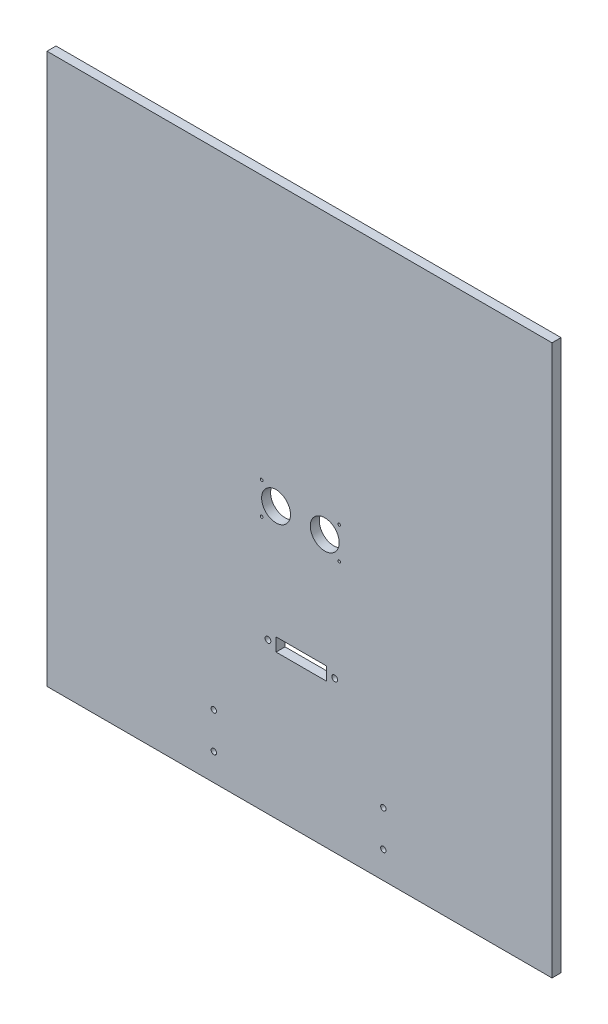
from build123d import *

# Parameters (mm, degrees)
ESQUISSE1_W             = 280
ESQUISSE1_H             = 305
BOSS_EXTRU_1_DEPTH      = 5
ESQUISSE2_R             = 1.5
ENL_V_MAT_EXTRU_1_DEPTH = 415.065212255
ESQUISSE3_R             = 1.5
ENL_V_MAT_EXTRU_2_DEPTH = 415.065212255
ESQUISSE4_R             = 1.6
ESQUISSE4_W             = 28
ESQUISSE4_H             = 7.3
ENL_V_MAT_EXTRU_3_DEPTH = 415.065212255
ESQUISSE5_R             = 8
ESQUISSE5_R_2           = 0.75
ENL_V_MAT_EXTRU_4_DEPTH = 415.065212255


with BuildPart() as part:
    # Esquisse1 → Boss.-Extru.1 (new body)
    with BuildSketch(Plane.XY):
        with Locations((140, 152.5)):
            Rectangle(ESQUISSE1_W, ESQUISSE1_H)
    extrude(amount=BOSS_EXTRU_1_DEPTH)

    # Esquisse2 → Enlèv. mat.-Extru.1 (cut, through all)
    with BuildSketch(Plane.XY.offset(5)):
        with Locations((92.5, 35)):
            Circle(ESQUISSE2_R)
        with Locations((92.5, 15)):
            Circle(ESQUISSE2_R)
        with Locations((186.5, 35)):
            Circle(ESQUISSE2_R)
        with Locations((186.5, 15)):
            Circle(ESQUISSE2_R)
    extrude(amount=-ENL_V_MAT_EXTRU_1_DEPTH, mode=Mode.SUBTRACT)

    # Esquisse3 → Enlèv. mat.-Extru.2 (cut, through all)
    with BuildSketch(Plane.XY.offset(5)):
        with Locations((187.5, 758.805531468)):
            Circle(ESQUISSE3_R)
        with Locations((187.5, 778.805531468)):
            Circle(ESQUISSE3_R)
        with Locations((93.5, 758.805531468)):
            Circle(ESQUISSE3_R)
        with Locations((93.5, 778.805531468)):
            Circle(ESQUISSE3_R)
    extrude(amount=-ENL_V_MAT_EXTRU_2_DEPTH, mode=Mode.SUBTRACT)

    # Esquisse4 → Enlèv. mat.-Extru.3 (cut, through all)
    with BuildSketch(Plane(origin=(0, 0, 0), x_dir=(-1, 0, 0), z_dir=(0, 0, -1))):
        with Locations((-159.5, 83.65)):
            Circle(ESQUISSE4_R)
        with Locations((-122.5, 83.65)):
            Circle(ESQUISSE4_R)
        with Locations((-141, 83.65)):
            Rectangle(ESQUISSE4_W, ESQUISSE4_H)
    extrude(amount=-ENL_V_MAT_EXTRU_3_DEPTH, mode=Mode.SUBTRACT)

    # Esquisse5 → Enlèv. mat.-Extru.4 (cut, through all)
    with BuildSketch(Plane(origin=(0, 0, 0), x_dir=(-1, 0, 0), z_dir=(0, 0, -1))):
        with Locations((-154, 150)):
            Circle(ESQUISSE5_R)
        with Locations((-127, 150)):
            Circle(ESQUISSE5_R)
        with Locations((-119, 158.7)):
            Circle(ESQUISSE5_R_2)
        with Locations((-162, 158.7)):
            Circle(ESQUISSE5_R_2)
        with Locations((-162, 141)):
            Circle(ESQUISSE5_R_2)
        with Locations((-119, 141)):
            Circle(ESQUISSE5_R_2)
    extrude(amount=-ENL_V_MAT_EXTRU_4_DEPTH, mode=Mode.SUBTRACT)


solid = part.part
